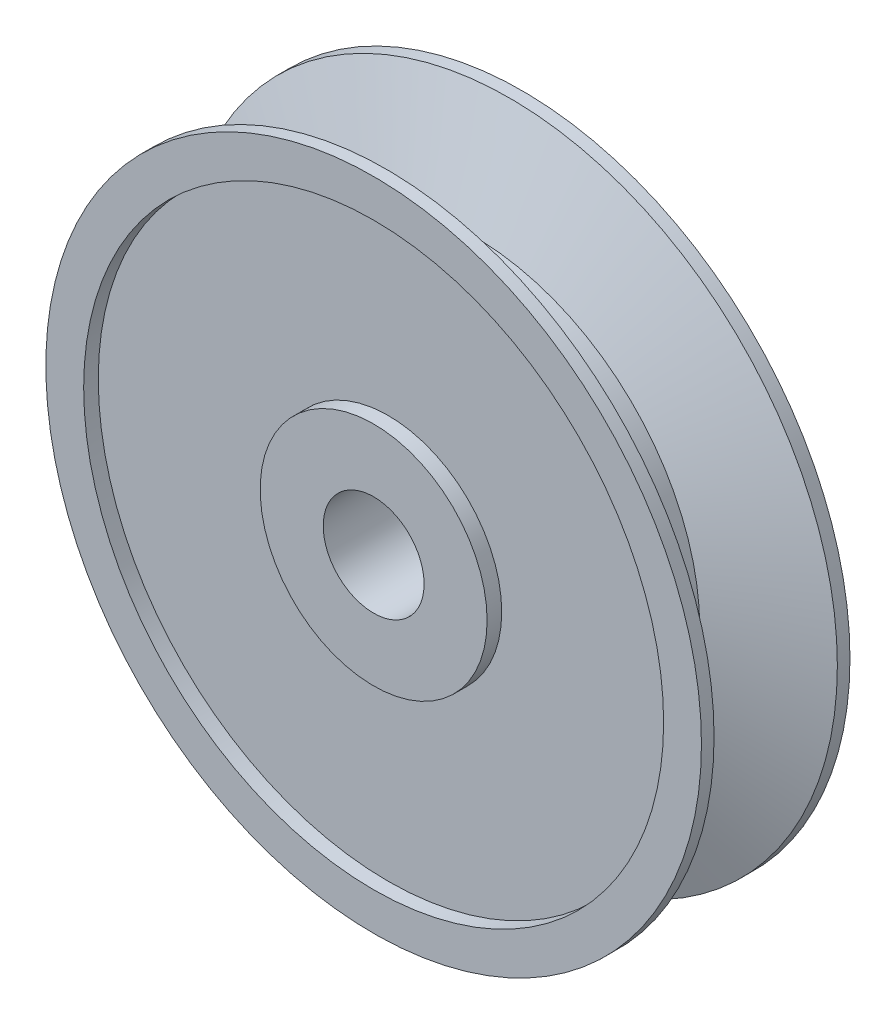
from build123d import *

# Parameters (mm, degrees)
BODY_MOVE_COPY1_ANGLE = 90


with BuildPart() as part:
    # Sketch1 → Revolve1 (revolve)
    with BuildSketch(Plane.XY, mode=Mode.PRIVATE) as revolve1_sk:
        Polygon((0, 4), (5.89, 4), (5.89, 9), (4.730911447, 9), (4.730911447, 23), (5.89, 23), (5.89, 26), (0, 26), align=None)
    revolve1 = revolve(revolve1_sk.sketch.rotate(Axis((0, 0, 0), (1, 0, 0)), 90), axis=Axis((0, 0, 0), (1, 0, 0)))

    # Sketch2 → Cut-Revolve1 (revolve, cut)
    with BuildSketch(Plane.XY, mode=Mode.PRIVATE) as cut_revolve1_sk:
        Polygon((0, 18), (1.977829822, 18), (4.889591697, 26), (0, 26), align=None)
    cut_revolve1 = revolve(cut_revolve1_sk.sketch.rotate(Axis((0, 0, 0), (1, 0, 0)), 90), axis=Axis((0, 0, 0), (1, 0, 0)), mode=Mode.SUBTRACT)

    # Mirror1: Revolve1, Cut-Revolve1 across Right Plane
    add(revolve1.mirror(Plane(origin=(0, 0, 0), x_dir=(0, 0, -1), z_dir=(1, 0, 0))))
    add(cut_revolve1.mirror(Plane(origin=(0, 0, 0), x_dir=(0, 0, -1), z_dir=(1, 0, 0))), mode=Mode.SUBTRACT)


with BuildPart() as part_1:
    # Body-Move/Copy1: moved
    add(part.part.rotate(Axis((0, 0, 0), (0, 1, 0)), BODY_MOVE_COPY1_ANGLE))


solid = part_1.part
